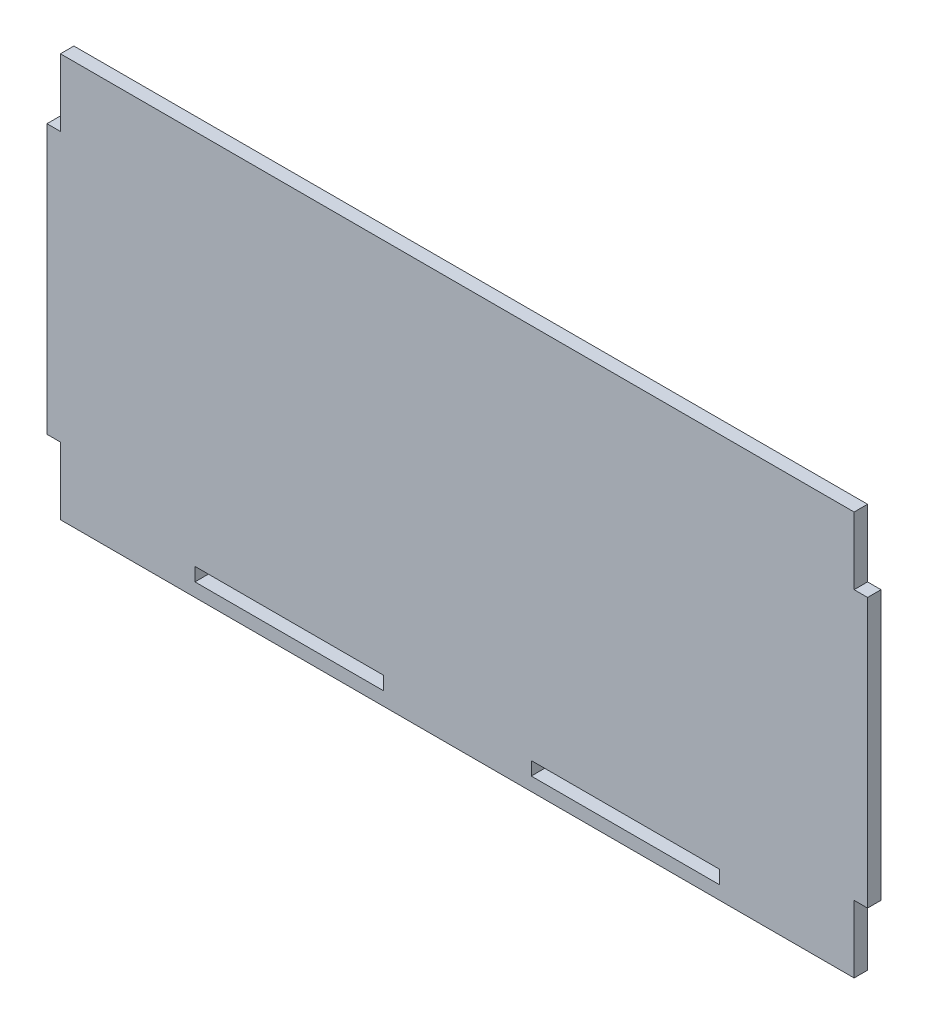
from build123d import *

# Parameters (mm, degrees)
SKETCH1_W           = 5
SKETCH1_H           = 100
SKETCH1_W_2         = 295
SKETCH1_H_2         = 150
BOSS_EXTRUDE1_DEPTH = 5
SKETCH2_W           = 70
SKETCH2_H           = 5
CUT_EXTRUDE1_DEPTH  = 5


with BuildPart() as part:
    # Sketch1 → Boss-Extrude1 (new body)
    with BuildSketch(Plane.XY):
        with Locations((-297.5, 75)):
            Rectangle(SKETCH1_W, SKETCH1_H)
        with Locations((-147.5, 75)):
            Rectangle(SKETCH1_W_2, SKETCH1_H_2)
        with Locations((2.5, 75)):
            Rectangle(SKETCH1_W, SKETCH1_H)
    extrude(amount=BOSS_EXTRUDE1_DEPTH)

    # Sketch2 → Cut-Extrude1 (cut)
    with BuildSketch(Plane.XY.offset(5)):
        with Locations((-210, 7.5)):
            Rectangle(SKETCH2_W, SKETCH2_H)
        with Locations((-85, 7.5)):
            Rectangle(SKETCH2_W, SKETCH2_H)
    extrude(amount=-CUT_EXTRUDE1_DEPTH, mode=Mode.SUBTRACT)


solid = part.part
